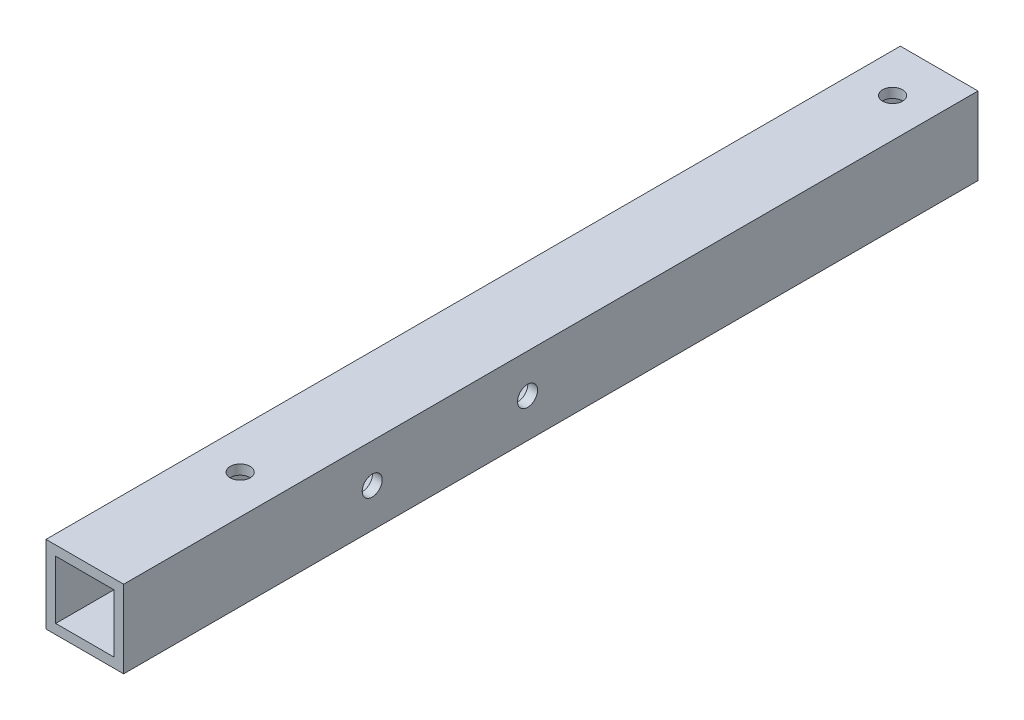
from build123d import *

# Parameters (mm, degrees)
SKETCH2_W           = 25.4
SKETCH2_H           = 25.4
BOSS_EXTRUDE1_DEPTH = 279.4
SKETCH4_W           = 19.05
SKETCH4_H           = 19.05
CUT_EXTRUDE1_DEPTH  = 280.9766776
SKETCH5_R           = 3.2639
CUT_EXTRUDE2_DEPTH  = 281.839473721
SKETCH6_R           = 3.2639
CUT_EXTRUDE3_DEPTH  = 281.839473721
SKETCH8_R           = 3.2639
CUT_EXTRUDE5_DEPTH  = 281.839473721


with BuildPart() as part:
    # Sketch2 → Boss-Extrude1 (new body)
    with BuildSketch(Plane.XY):
        Rectangle(SKETCH2_W, SKETCH2_H)
    extrude(amount=BOSS_EXTRUDE1_DEPTH)

    # Sketch4 → Cut-Extrude1 (cut, through all)
    with BuildSketch(Plane.XY):
        Rectangle(SKETCH4_W, SKETCH4_H)
    extrude(amount=CUT_EXTRUDE1_DEPTH, mode=Mode.SUBTRACT)

    # Sketch5 → Cut-Extrude2 (cut, through all)
    with BuildSketch(Plane(origin=(0, 12.7, 0), x_dir=(1, 0, 0), z_dir=(0, 1, 0))):
        with Locations(Location((0, -15.24, 0), (0, 0, 270))):
            Circle(SKETCH5_R)
    extrude(amount=-CUT_EXTRUDE2_DEPTH, mode=Mode.SUBTRACT)

    # Sketch6 → Cut-Extrude3 (cut, through all)
    with BuildSketch(Plane(origin=(0, 12.7, 0), x_dir=(1, 0, 0), z_dir=(0, 1, 0))):
        with Locations(Location((0, -228.6, 0), (0, 0, 270))):
            Circle(SKETCH6_R)
    extrude(amount=-CUT_EXTRUDE3_DEPTH, mode=Mode.SUBTRACT)

    # Sketch8 → Cut-Extrude5 (cut, through all)
    with BuildSketch(Plane.ZY.offset(12.7)):
        with Locations((198.12, 0)):
            Circle(SKETCH8_R)
        with Locations((147.32, 0)):
            Circle(SKETCH8_R)
    extrude(amount=-CUT_EXTRUDE5_DEPTH, mode=Mode.SUBTRACT)


solid = part.part
